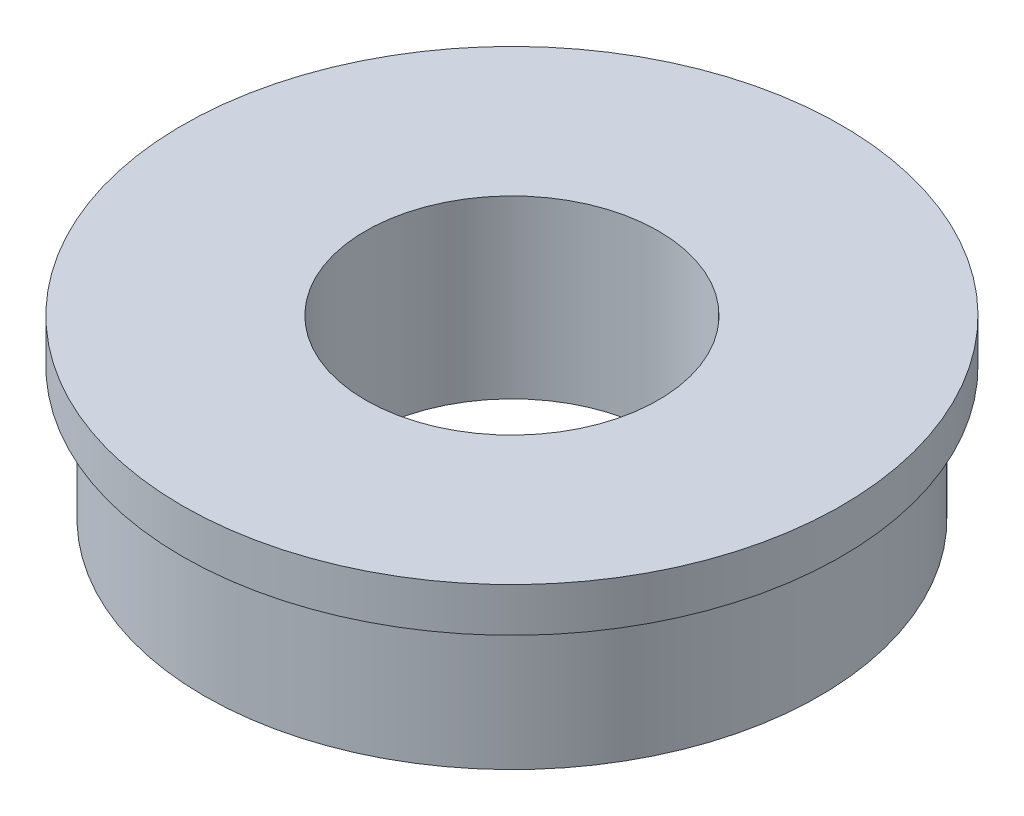
from build123d import *

# Parameters (mm, degrees)
SKETCH1_R           = 21
SKETCH1_R_2         = 10
BOSS_EXTRUDE1_DEPTH = 9
SKETCH2_R           = 22.5
SKETCH2_R_2         = 10
BOSS_EXTRUDE2_DEPTH = 3


with BuildPart() as part:
    # Sketch1 → Boss-Extrude1 (new body)
    with BuildSketch(Plane(origin=(0, 0, 0), x_dir=(1, 0, 0), z_dir=(0, 1, 0))):
        with Locations(Location((0, 0, 0), (0, 0, 270))):
            Circle(SKETCH1_R)
        with Locations(Location((0, 0, 0), (0, 0, 270))):
            Circle(SKETCH1_R_2, mode=Mode.SUBTRACT)
    extrude(amount=BOSS_EXTRUDE1_DEPTH)

    # Sketch2 → Boss-Extrude2 (add)
    with BuildSketch(Plane(origin=(0, 9, 0), x_dir=(1, 0, 0), z_dir=(0, 1, 0))):
        with Locations(Location((0, 0, 0), (0, 0, 270))):
            Circle(SKETCH2_R)
        with Locations(Location((0, 0, 0), (0, 0, 270))):
            Circle(SKETCH2_R_2, mode=Mode.SUBTRACT)
    extrude(amount=BOSS_EXTRUDE2_DEPTH)


solid = part.part
